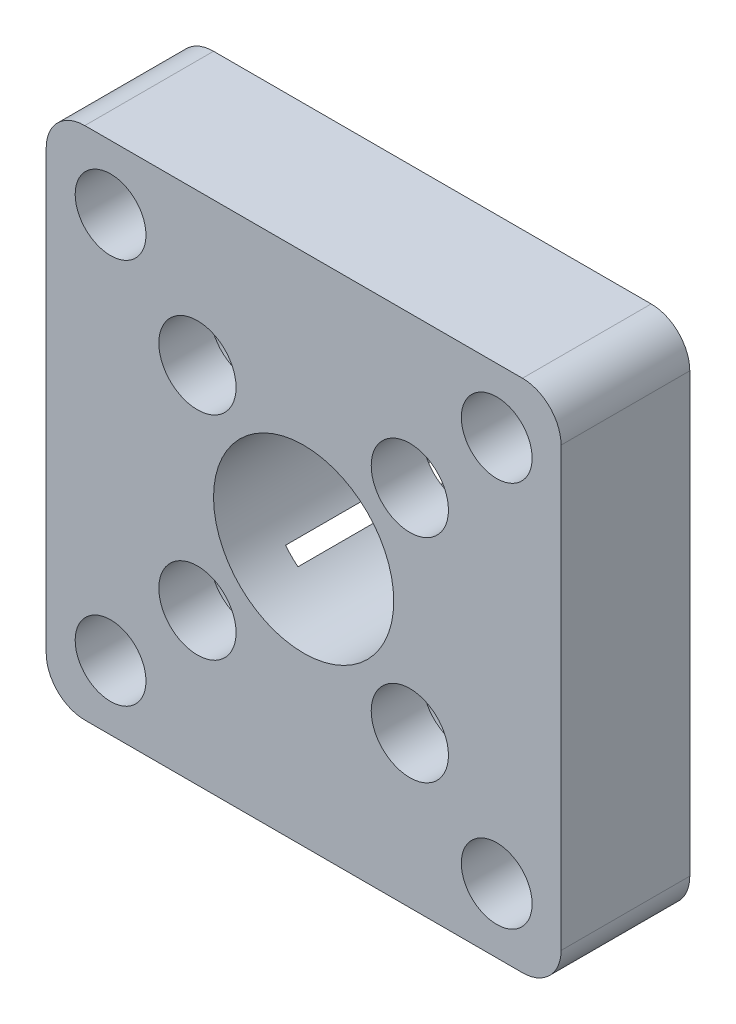
from build123d import *

# Parameters (mm, degrees)
SKETCH_1_R          = 3
SKETCH_1_R_2        = 7
SKETCH_1_R_3        = 2.75
EXTRUDE_1_DEPTH     = 10
SKETCH_2_R          = 4.75
CUT_EXTRUDE_2_DEPTH = 6


with BuildPart() as part:
    # 草图1 → 拉伸1 (new body)
    with BuildSketch(Plane.XY):
        with BuildLine():
            Line((1190.508500062, 1011.627141179), (1190.508500062, 977.627141179))
            ThreePointArc((1190.508500062, 977.627141179), (1191.387179719, 975.505820835), (1193.508500062, 974.627141179))
            Line((1193.508500062, 974.627141179), (1227.508500062, 974.627141179))
            ThreePointArc((1227.508500062, 974.627141179), (1229.629820406, 975.505820835), (1230.508500062, 977.627141179))
            Line((1230.508500062, 977.627141179), (1230.508500062, 1011.627141179))
            ThreePointArc((1230.508500062, 1011.627141179), (1229.629820406, 1013.748461522), (1227.508500062, 1014.627141179))
            Line((1227.508500062, 1014.627141179), (1193.508500062, 1014.627141179))
            ThreePointArc((1193.508500062, 1014.627141179), (1191.387179719, 1013.748461522), (1190.508500062, 1011.627141179))
        make_face()
        with Locations((1218.758500062, 1002.877141179)):
            Circle(SKETCH_1_R, mode=Mode.SUBTRACT)
        with Locations((1218.758500062, 986.377141179)):
            Circle(SKETCH_1_R, mode=Mode.SUBTRACT)
        with Locations((1202.258500062, 1002.877141179)):
            Circle(SKETCH_1_R, mode=Mode.SUBTRACT)
        with Locations((1202.258500062, 986.377141179)):
            Circle(SKETCH_1_R, mode=Mode.SUBTRACT)
        with Locations((1210.508500062, 994.627141179)):
            Circle(SKETCH_1_R_2, mode=Mode.SUBTRACT)
        with Locations((1195.508500062, 1009.627141179)):
            Circle(SKETCH_1_R_3, mode=Mode.SUBTRACT)
        with Locations((1225.508500062, 1009.627141179)):
            Circle(SKETCH_1_R_3, mode=Mode.SUBTRACT)
        with Locations((1225.508500062, 979.627141179)):
            Circle(SKETCH_1_R_3, mode=Mode.SUBTRACT)
        with Locations((1195.508500062, 979.627141179)):
            Circle(SKETCH_1_R_3, mode=Mode.SUBTRACT)
    extrude(amount=EXTRUDE_1_DEPTH)

    # 草图2 → 拉伸2 (cut)
    with BuildSketch(Plane(origin=(0, 0, 0), x_dir=(-1, 0, 0), z_dir=(0, 0, -1))):
        with Locations((-1225.508500062, 1009.627141179)):
            Circle(SKETCH_2_R)
        with Locations((-1195.508500062, 1009.627141179)):
            Circle(SKETCH_2_R)
        with Locations((-1225.508500062, 979.627141179)):
            Circle(SKETCH_2_R)
        with Locations((-1195.508500062, 979.627141179)):
            Circle(SKETCH_2_R)
        with Locations((-1218.758500062, 1002.877141179)):
            Circle(SKETCH_2_R)
        with Locations((-1202.258500062, 1002.877141179)):
            Circle(SKETCH_2_R)
        with Locations((-1218.758500062, 986.377141179)):
            Circle(SKETCH_2_R)
        with Locations((-1202.258500062, 986.377141179)):
            Circle(SKETCH_2_R)
    extrude(amount=-CUT_EXTRUDE_2_DEPTH, mode=Mode.SUBTRACT)


solid = part.part
